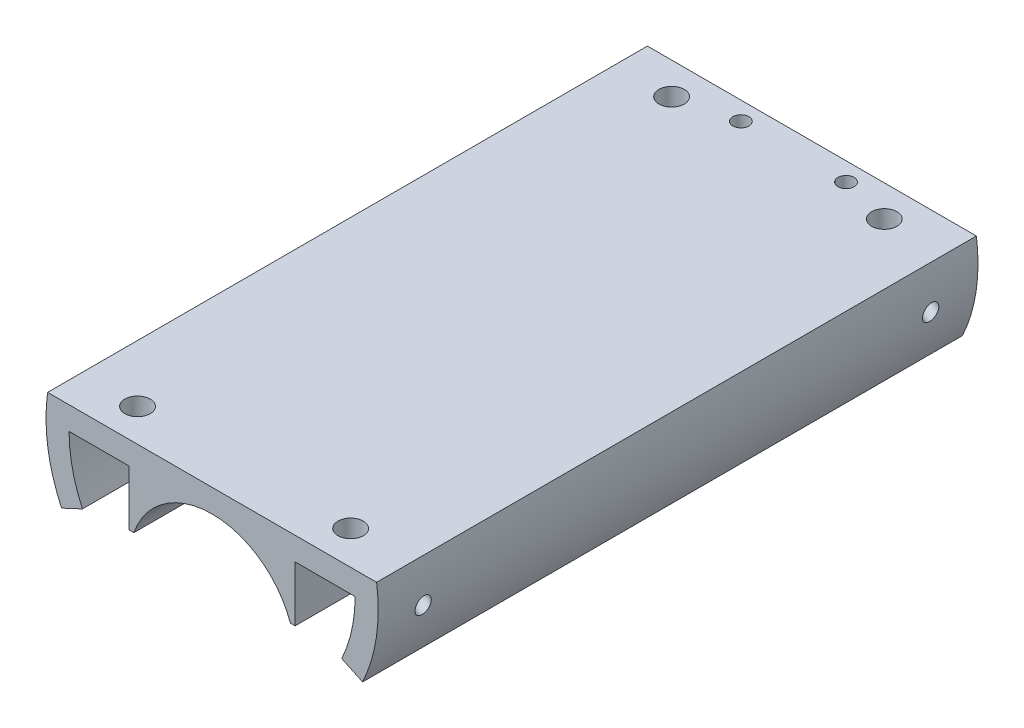
from build123d import *

# Parameters (mm, degrees)
BOSS_EXTRUDE1_DEPTH     = 65
CUT_EXTRUDE1_REACH      = 70.199
SKETCH2_R               = 1.374999977
SKETCH2_R_2             = 1.374999979
SKETCH2_R_3             = 1.374999935
SKETCH2_R_4             = 1.374999972
BOSS_EXTRUDE2_DEPTH     = 65
CUT_EXTRUDE2_REACH      = 76.064
CUT_EXTRUDE2_END_RADIUS = 15.5
SKETCH4_R               = 0.875
CUT_EXTRUDE3_REACH      = 70.199
CUT_EXTRUDE3_END_RADIUS = 9
SKETCH5_R               = 0.875


with BuildPart() as part:
    # Sketch1 → Boss-Extrude1 (new body)
    with BuildSketch(Plane.XY):
        with BuildLine():
            ThreePointArc((16.313540167, -7.607128711), (17.573328128, -3.895913051), (18, 0))
            Line((18, 0), (15.5, 0))
            ThreePointArc((15.5, 0), (15.13258811, -3.354814016), (14.047770699, -6.550583057))
            Line((14.047770699, -6.550583057), (16.313540167, -7.607128711))
        make_face()
        with BuildLine():
            Line((15.5, 0), (18, 0))
            ThreePointArc((18, 0), (17.9563329, 1.253039812), (17.82554347, 2.5))
            Line((17.82554347, 2.5), (15.297058541, 2.5))
            ThreePointArc((15.297058541, 2.5), (15.449181328, 1.254111761), (15.5, 0))
        make_face()
        with BuildLine():
            Line((-15.297058541, 2.5), (-17.82554347, 2.5))
            ThreePointArc((-17.82554347, 2.5), (-17.9563329, 1.253039812), (-18, 0))
            Line((-18, 0), (-15.5, 0))
            ThreePointArc((-15.5, 0), (-15.449181328, 1.254111761), (-15.297058541, 2.5))
        make_face()
        with BuildLine():
            Line((0, 0), (15.5, 0))
            ThreePointArc((15.5, 0), (15.449181328, 1.254111761), (15.297058541, 2.5))
            Line((15.297058541, 2.5), (-15.297058541, 2.5))
            ThreePointArc((-15.297058541, 2.5), (-15.449181328, 1.254111761), (-15.5, 0))
            Line((-15.5, 0), (0, 0))
        make_face()
        with BuildLine():
            ThreePointArc((-18, 0), (-17.573328128, -3.895913051), (-16.313540167, -7.607128711))
            Line((-16.313540167, -7.607128711), (-14.047770699, -6.550583057))
            ThreePointArc((-14.047770699, -6.550583057), (-15.13258811, -3.354814016), (-15.5, 0))
            Line((-15.5, 0), (-18, 0))
        make_face()
    extrude(amount=BOSS_EXTRUDE1_DEPTH)

    # Sketch2 → Cut-Extrude1 (cut, up to next)
    with BuildSketch(Plane(origin=(0, 2.5, 0), x_dir=(1, 0, 0), z_dir=(0, 1, 0)), mode=Mode.PRIVATE) as cut_extrude1_sk1:
        with Locations(Location((11.239474716, -3.394559676, 0), (0, 0, 270))):
            Circle(SKETCH2_R)
    cut_extrude1_tool1 = extrude(cut_extrude1_sk1.sketch, amount=-CUT_EXTRUDE1_REACH, mode=Mode.PRIVATE) & part.part
    # Sketch2 → Cut-Extrude1 (cut, up to next)
    with BuildSketch(Plane(origin=(0, 2.5, 0), x_dir=(1, 0, 0), z_dir=(0, 1, 0)), mode=Mode.PRIVATE) as cut_extrude1_sk2:
        with Locations(Location((-11.760472903, -3.443135131, 0), (0, 0, 270))):
            Circle(SKETCH2_R_2)
    cut_extrude1_tool2 = extrude(cut_extrude1_sk2.sketch, amount=-CUT_EXTRUDE1_REACH, mode=Mode.PRIVATE) & part.part
    # Sketch2 → Cut-Extrude1 (cut, up to next)
    with BuildSketch(Plane(origin=(0, 2.5, 0), x_dir=(1, 0, 0), z_dir=(0, 1, 0)), mode=Mode.PRIVATE) as cut_extrude1_sk3:
        with Locations(Location((11.361823253, -61.347443071, 0), (0, 0, 270))):
            Circle(SKETCH2_R_3)
    cut_extrude1_tool3 = extrude(cut_extrude1_sk3.sketch, amount=-CUT_EXTRUDE1_REACH, mode=Mode.PRIVATE) & part.part
    # Sketch2 → Cut-Extrude1 (cut, up to next)
    with BuildSketch(Plane(origin=(0, 2.5, 0), x_dir=(1, 0, 0), z_dir=(0, 1, 0)), mode=Mode.PRIVATE) as cut_extrude1_sk4:
        with Locations(Location((-11.637978285, -61.443005778, 0), (0, 0, 270))):
            Circle(SKETCH2_R_4)
    cut_extrude1_tool4 = extrude(cut_extrude1_sk4.sketch, amount=-CUT_EXTRUDE1_REACH, mode=Mode.PRIVATE) & part.part
    add(cut_extrude1_tool1.solids().sort_by_distance((11.239475, 2.5, 3.39456))[0], mode=Mode.SUBTRACT)
    add(cut_extrude1_tool2.solids().sort_by_distance((-11.760473, 2.5, 3.443135))[0], mode=Mode.SUBTRACT)
    add(cut_extrude1_tool3.solids().sort_by_distance((11.361823, 2.5, 61.347443))[0], mode=Mode.SUBTRACT)
    add(cut_extrude1_tool4.solids().sort_by_distance((-11.637978, 2.5, 61.443006))[0], mode=Mode.SUBTRACT)

    # Sketch3 → Boss-Extrude2 (add)
    with BuildSketch(Plane.XY.offset(65)):
        with BuildLine():
            Line((-9, 0), (-9, -6))
            Line((-9, -6), (-8.485281374, -6))
            ThreePointArc((-8.485281374, -6), (-5.196152423, -1.651530772), (0, 0))
            Line((0, 0), (-9, 0))
        make_face()
        with BuildLine():
            ThreePointArc((0, 0), (5.196152423, -1.651530772), (8.485281374, -6))
            Line((8.485281374, -6), (9, -6))
            Line((9, -6), (9, 0))
            Line((9, 0), (0, 0))
        make_face()
    extrude(amount=-BOSS_EXTRUDE2_DEPTH)

    # Cut-Extrude2: up to this cylinder (the profile starts outside it)
    cut_extrude2_end = Plane(origin=(0, 0, 32.5), z_dir=(0, 0, -1)) * Cylinder(CUT_EXTRUDE2_END_RADIUS, 239.128, mode=Mode.PRIVATE)
    # Sketch4 → Cut-Extrude2 (cut, up to the surface)
    with BuildSketch(Plane(origin=(-15.588457268, -9, 0), x_dir=(0, 0, -1), z_dir=(-0.866025403784438, -0.500000000000001, 0)), mode=Mode.PRIVATE) as cut_extrude2_sk1:
        with Locations(Location((-60, -7.077835244, 0), (0, 0, 90))):
            Circle(SKETCH4_R)
    cut_extrude2_tool1 = extrude(cut_extrude2_sk1.sketch, amount=-CUT_EXTRUDE2_REACH, mode=Mode.PRIVATE) - cut_extrude2_end
    # Sketch4 → Cut-Extrude2 (cut, up to the surface)
    with BuildSketch(Plane(origin=(-15.588457268, -9, 0), x_dir=(0, 0, -1), z_dir=(-0.866025403784438, -0.500000000000001, 0)), mode=Mode.PRIVATE) as cut_extrude2_sk2:
        with Locations(Location((-5, -7.077835244, 0), (0, 0, 90))):
            Circle(SKETCH4_R)
    cut_extrude2_tool2 = extrude(cut_extrude2_sk2.sketch, amount=-CUT_EXTRUDE2_REACH, mode=Mode.PRIVATE) - cut_extrude2_end
    cut_extrude2 = cut_extrude2_tool1.solids().sort_by_distance((-19.127375, -2.870415, 60))[0] + cut_extrude2_tool2.solids().sort_by_distance((-19.127375, -2.870415, 5))[0]
    add(cut_extrude2, mode=Mode.SUBTRACT)

    # Mirror1: Cut-Extrude2 across plane
    add(cut_extrude2.mirror(Plane(origin=(0, 0, 0), x_dir=(0, 0, 1), z_dir=(1, 0, 0))), mode=Mode.SUBTRACT)

    # Cut-Extrude3: up to this cylinder (the profile starts outside it)
    cut_extrude3_end = Plane(origin=(0, -9, 2), z_dir=(0, 0, 1)) * Cylinder(CUT_EXTRUDE3_END_RADIUS, 159.398, mode=Mode.PRIVATE)
    # Sketch5 → Cut-Extrude3 (cut, up to the surface)
    with BuildSketch(Plane(origin=(0, 2.5, 0), x_dir=(1, 0, 0), z_dir=(0, 1, 0)), mode=Mode.PRIVATE) as cut_extrude3_sk1:
        with Locations(Location((-5.7, -2, 0), (0, 0, 270))):
            Circle(SKETCH5_R)
    cut_extrude3_tool1 = extrude(cut_extrude3_sk1.sketch, amount=-CUT_EXTRUDE3_REACH, mode=Mode.PRIVATE) - cut_extrude3_end
    add(cut_extrude3_tool1.solids().sort_by_distance((-5.7, 2.5, 2))[0], mode=Mode.SUBTRACT)
    # Sketch5 → Cut-Extrude3 (cut, up to the surface)
    with BuildSketch(Plane(origin=(0, 2.5, 0), x_dir=(1, 0, 0), z_dir=(0, 1, 0)), mode=Mode.PRIVATE) as cut_extrude3_sk2:
        with Locations(Location((5.7, -2, 0), (0, 0, 270))):
            Circle(SKETCH5_R)
    cut_extrude3_tool2 = extrude(cut_extrude3_sk2.sketch, amount=-CUT_EXTRUDE3_REACH, mode=Mode.PRIVATE) - cut_extrude3_end
    add(cut_extrude3_tool2.solids().sort_by_distance((5.7, 2.5, 2))[0], mode=Mode.SUBTRACT)


solid = part.part
